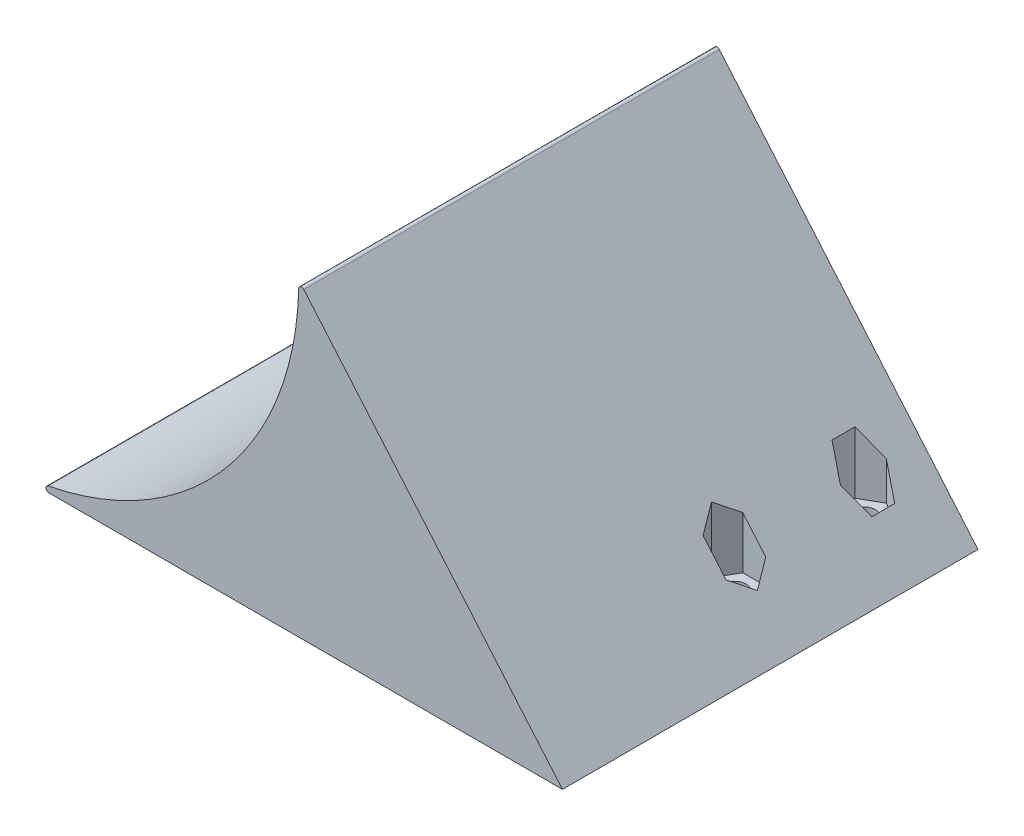
from build123d import *

# Parameters (mm, degrees)
EXTRUDE_1_DEPTH     = 72.5
FILLET_1_R          = 0.5
CUT_EXTRUDE_1_DEPTH = 49
SKETCH_5_R          = 2.05
CUT_EXTRUDE_2_DEPTH = 5
SKETCH_6_R          = 74.194648386
CUT_EXTRUDE_3_DEPTH = 135.804488056


with BuildPart() as part:
    # 草图3 → 凸台-拉伸1 (new, symmetric)
    with BuildSketch(Plane.XY):
        with BuildLine():
            Line((100, -54), (0, -54))
            ThreePointArc((0, -54), (38.183766184, -38.183766184), (54, 0))
            Line((54, 0), (100, -54))
        make_face()
    extrude(amount=EXTRUDE_1_DEPTH, both=True)

    # 圆角1
    fillet_1_edges = [part.edges().sort_by_distance(p)[0] for p in [
        (54, 0, 0),
        (0, -54, 0),
    ]]
    fillet(fillet_1_edges, radius=FILLET_1_R)

    # 草图4 → 切除-拉伸1 (cut)
    with BuildSketch(Plane(origin=(0, 0, 0), x_dir=(1, 0, 0), z_dir=(0, 1, 0))):
        Polygon((93.464101615, -64.5), (93.464101615, -60.5), (90, -58.5), (86.535898385, -60.5), (86.535898385, -64.5), (90, -66.5), align=None)
        Polygon((29.892304845, -58.5), (26.42820323, -60.5), (26.42820323, -64.5), (29.892304845, -66.5), (33.356406461, -64.5), (33.356406461, -60.5), align=None)
        Polygon((33.356406461, 60.5), (29.892304845, 58.5), (26.42820323, 60.5), (26.42820323, 64.5), (29.892304845, 66.5), (33.356406461, 64.5), align=None)
        Polygon((90, 66.5), (93.464101615, 64.5), (93.464101615, 60.5), (90, 58.5), (86.535898385, 60.5), (86.535898385, 64.5), align=None)
        Polygon((92, -36.535898385), (88, -36.535898385), (86, -40), (88, -43.464101615), (92, -43.464101615), (94, -40), align=None)
        Polygon((94, 40), (92, 43.464101615), (88, 43.464101615), (86, 40), (88, 36.535898385), (92, 36.535898385), align=None)
    extrude(amount=-CUT_EXTRUDE_1_DEPTH, mode=Mode.SUBTRACT)

    # 草图5 → 切除-拉伸2 (cut)
    with BuildSketch(Plane(origin=(0, -49, 0), x_dir=(1, 0, 0), z_dir=(0, 1, 0))):
        with Locations(Location((29.892304845, -62.5, 0), (0, 0, 180))):
            Circle(SKETCH_5_R)
        with Locations((29.892304845, 62.5)):
            Circle(SKETCH_5_R)
        with Locations(Location((90, 62.5, 0), (0, 0, 180))):
            Circle(SKETCH_5_R)
        with Locations((90, -62.5)):
            Circle(SKETCH_5_R)
        with Locations(Location((90, 40, 0), (0, 0, 180))):
            Circle(SKETCH_5_R)
        with Locations(Location((90, -40.064560571, 0), (0, 0, 180))):
            Circle(SKETCH_5_R)
    extrude(amount=-CUT_EXTRUDE_2_DEPTH, mode=Mode.SUBTRACT)

    # 草图6 → 切除-拉伸3 (cut, through all)
    with BuildSketch(Plane.XY):
        with Locations((51.898746265, -54)):
            Circle(SKETCH_6_R)
    extrude(amount=CUT_EXTRUDE_3_DEPTH, mode=Mode.SUBTRACT)


solid = part.part
